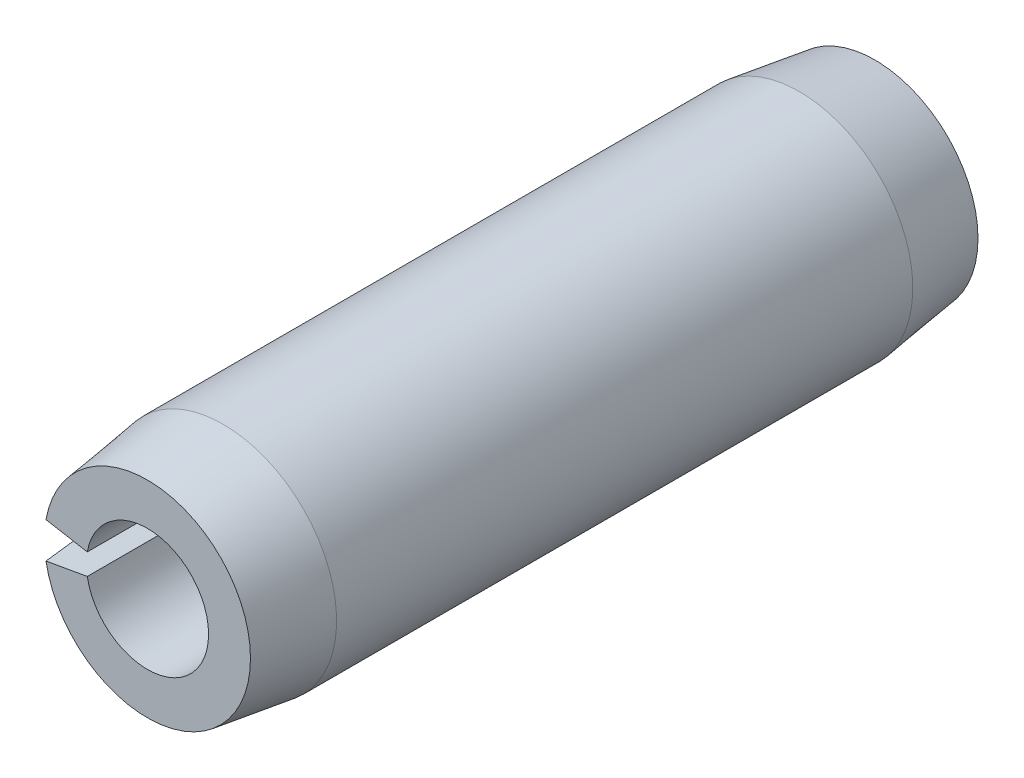
from build123d import *

# Parameters (mm, degrees)
EXTRUDE1_DEPTH      = 3.175
EXTRUDE1_DEPTH_BACK = 3.175


with BuildPart() as part:
    # Sketch1 → Extrude1 (new, two sides: drawn at the far end of the back side and taken through both)
    with BuildSketch(Plane.XY.offset(-EXTRUDE1_DEPTH_BACK)):
        with BuildLine():
            Line((-0.525296455, -0.092623938), (-0.97555056, -0.172015885))
            ThreePointArc((-0.97555056, -0.172015885), (0.9906, 0), (-0.97555056, 0.172015885))
            Line((-0.97555056, 0.172015885), (-0.525296455, 0.092623938))
            ThreePointArc((-0.525296455, 0.092623938), (0.5334, 0), (-0.525296455, -0.092623938))
        make_face()
    extrude(amount=EXTRUDE1_DEPTH + EXTRUDE1_DEPTH_BACK)

    # Sketch2 → Cut-Revolve1 (revolve, cut)
    with BuildSketch(Plane(origin=(0, 0, 0), x_dir=(0, 0, -1), z_dir=(1, 0, 0))):
        Polygon((3.175, 0.89916), (2.5146, 0.9906), (3.175, 0.9906), align=None)
    cut_revolve1 = revolve(axis=Axis((0, 0, -3.175), (0, 0, 1)), mode=Mode.SUBTRACT)

    # Mirror1: Cut-Revolve1 across plane
    add(cut_revolve1.mirror(Plane.XY), mode=Mode.SUBTRACT)


solid = part.part
